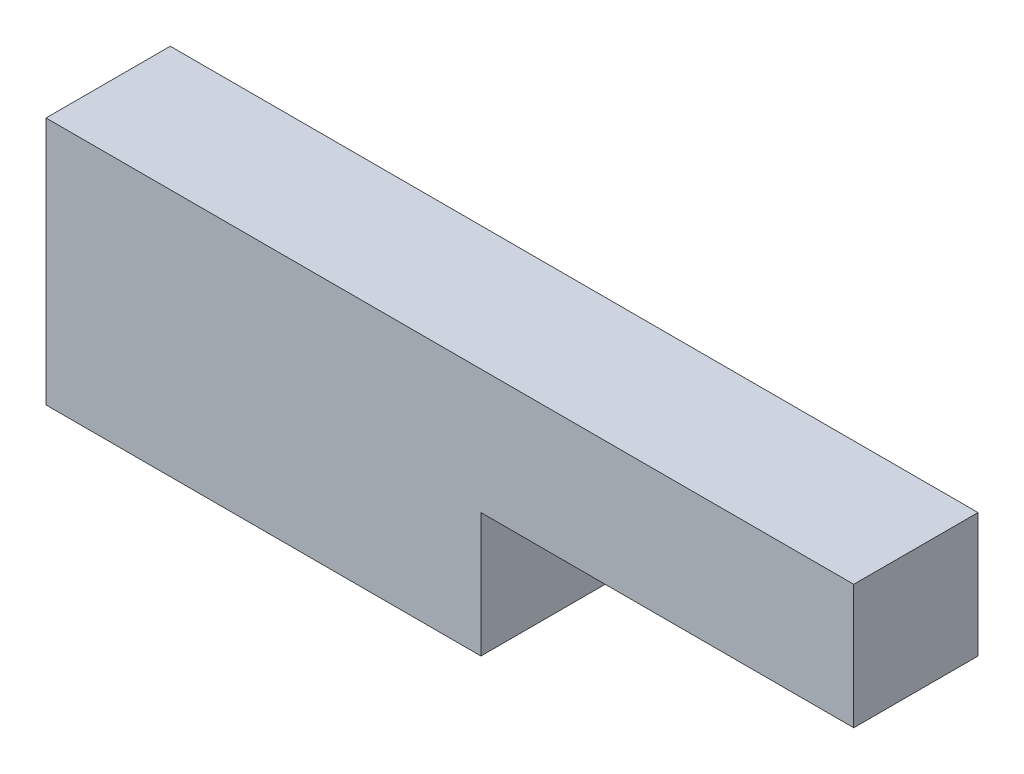
from build123d import *

# Parameters (mm, degrees)
BOSS_EXTRUDE1_DEPTH = 50.8


with BuildPart() as part:
    # Sketch1 → Boss-Extrude1 (new body)
    with BuildSketch(Plane.XY):
        Polygon((0, 0), (0, 101.6), (330.2, 101.6), (330.2, 50.8), (177.8, 50.8), (177.8, 0), align=None)
    extrude(amount=BOSS_EXTRUDE1_DEPTH)


solid = part.part
